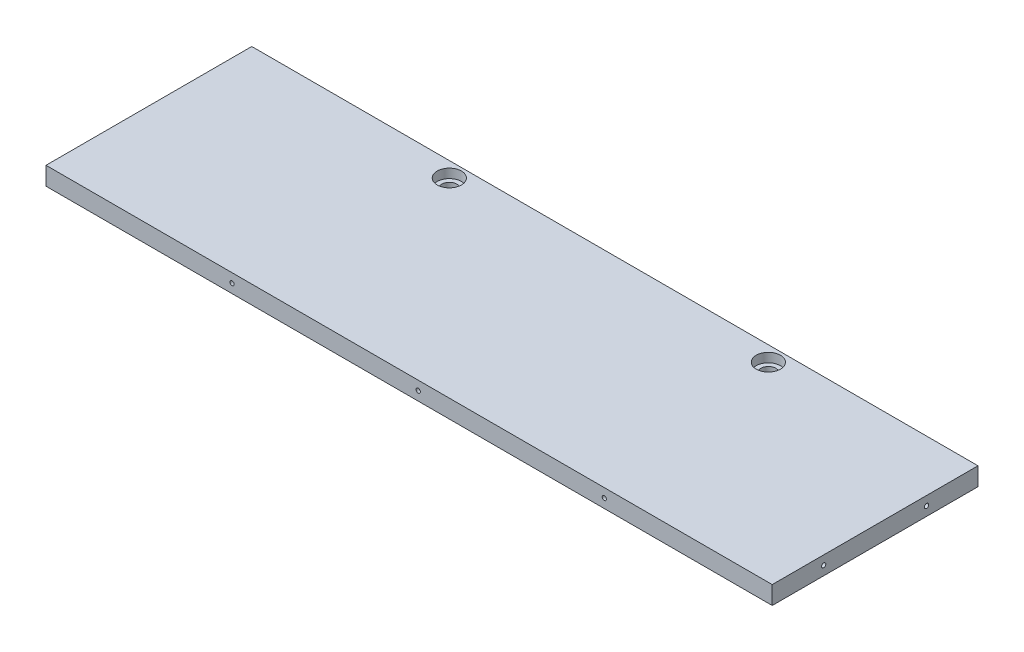
from build123d import *

# Parameters (mm, degrees)
SKETCH_1_W          = 120
SKETCH_1_H          = 34
EXTRUDE_1_DEPTH     = 3
SKETCH_2_R          = 1.25
CUT_EXTRUDE_1_DEPTH = 63.433965115
SKETCH_2_3_R        = 2
CUT_EXTRUDE_2_DEPTH = 1.5
SKETCH_3_R          = 0.35
CUT_EXTRUDE_3_DEPTH = 3
SKETCH_4_R          = 0.35
CUT_EXTRUDE_4_DEPTH = 3


with BuildPart() as part:
    # 草图1 → 凸台-拉伸1 (new body)
    with BuildSketch(Plane(origin=(0, 0, 0), x_dir=(1, 0, 0), z_dir=(0, 1, 0))):
        Rectangle(SKETCH_1_W, SKETCH_1_H)
    extrude(amount=EXTRUDE_1_DEPTH)

    # 草图2 → 切除-拉伸1 (cut, through all)
    with BuildSketch(Plane(origin=(0, 3, 0), x_dir=(1, 0, 0), z_dir=(0, 1, 0))):
        with Locations((-24.857141963, 14.500000041)):
            Circle(SKETCH_2_R)
        with Locations((27.857143751, 14.500000041)):
            Circle(SKETCH_2_R)
    extrude(amount=-CUT_EXTRUDE_1_DEPTH, mode=Mode.SUBTRACT)

    # 草图2<3> → 切除-拉伸2 (cut)
    with BuildSketch(Plane(origin=(0, 3, 0), x_dir=(1, 0, 0), z_dir=(0, 1, 0))):
        with Locations((-24.857141963, 14.500000041)):
            Circle(SKETCH_2_3_R)
        with Locations((27.857143751, 14.500000041)):
            Circle(SKETCH_2_3_R)
    extrude(amount=-CUT_EXTRUDE_2_DEPTH, mode=Mode.SUBTRACT)

    # 草图3 → 切除-拉伸3 (cut)
    with BuildSketch(Plane(origin=(60, 0, 0), x_dir=(0, 0, -1), z_dir=(1, 0, 0))):
        with Locations((-8.5, 1.5)):
            Circle(SKETCH_3_R)
        with Locations((8.5, 1.5)):
            Circle(SKETCH_3_R)
    extrude(amount=-CUT_EXTRUDE_3_DEPTH, mode=Mode.SUBTRACT)

    # 草图4 → 切除-拉伸4 (cut)
    with BuildSketch(Plane.XY.offset(17)):
        with Locations((-29.25, 1.5)):
            Circle(SKETCH_4_R)
        with Locations((1.5, 1.5)):
            Circle(SKETCH_4_R)
        with Locations((32.25, 1.5)):
            Circle(SKETCH_4_R)
    extrude(amount=-CUT_EXTRUDE_4_DEPTH, mode=Mode.SUBTRACT)


solid = part.part
